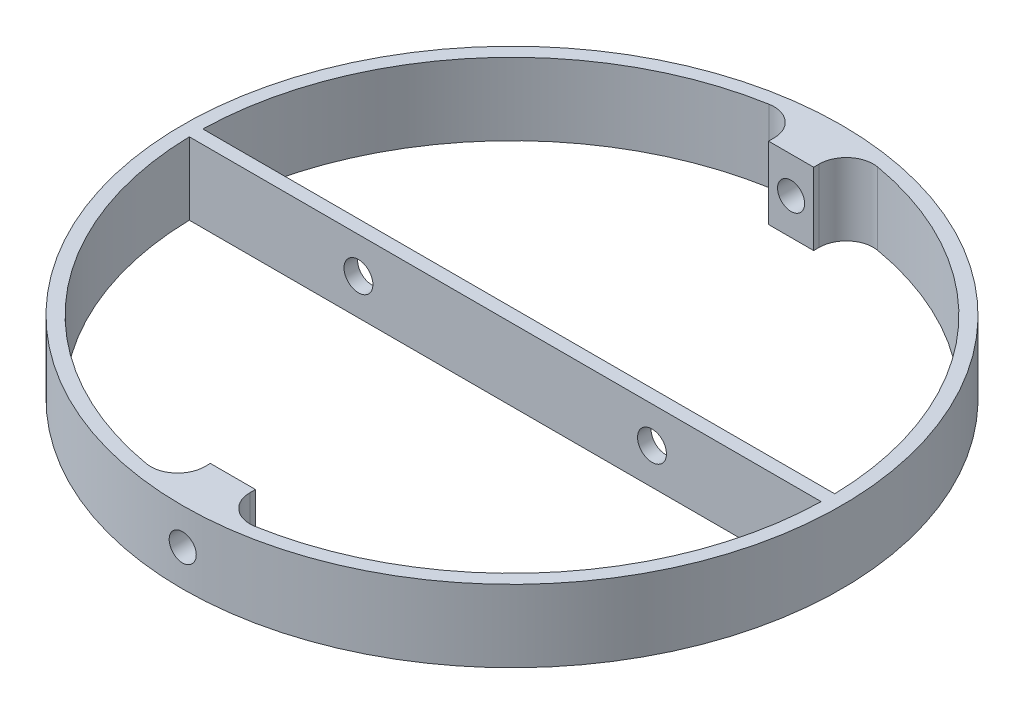
from build123d import *

# Parameters (mm, degrees)
ESQUISSE1_R             = 36.5
ESQUISSE1_R_2           = 35
BOSS_EXTRU_1_DEPTH      = 4
ENL_V_MAT_EXTRU_1_REACH = 83.714
ESQUISSE3_R             = 1.5
ENL_V_MAT_EXTRU_2_REACH = 54.305
ESQUISSE2_R             = 1.6
CONG_1_R                = 3


with BuildPart() as part:
    # Esquisse1 → Boss.-Extru.1 (new, symmetric)
    # profile 1 of 7: a face of its own
    with BuildSketch(Plane(origin=(0, 0, 0), x_dir=(1, 0, 0), z_dir=(0, 1, 0))):
        with Locations(Location((0, 0, 0), (0, 0, 270))):
            Circle(ESQUISSE1_R)
        Circle(ESQUISSE1_R_2, mode=Mode.SUBTRACT)
    # profile 2 of 7: a face of its own
    with BuildSketch(Plane(origin=(0, 0, 0), x_dir=(1, 0, 0), z_dir=(0, 1, 0))):
        with BuildLine():
            Line((34.991963363, 0.75), (0, 0.75))
            Line((0, 0.75), (0, -0.75))
            Line((0, -0.75), (34.991963363, -0.75))
            ThreePointArc((34.991963363, -0.75), (34.997990783, -0.375021529), (35, 0))
            ThreePointArc((35, 0), (34.997990783, 0.375021529), (34.991963363, 0.75))
        make_face()
    # profile 3 of 7: a face of its own
    with BuildSketch(Plane(origin=(0, 0, 0), x_dir=(1, 0, 0), z_dir=(0, 1, 0))):
        with BuildLine():
            Line((0, 0.75), (-34.991963363, 0.75))
            ThreePointArc((-34.991963363, 0.75), (-35, 0), (-34.991963363, -0.75))
            Line((-34.991963363, -0.75), (0, -0.75))
            Line((0, -0.75), (0, 0.75))
        make_face()
    # profile 4 of 7: a face of its own
    with BuildSketch(Plane(origin=(0, 0, 0), x_dir=(1, 0, 0), z_dir=(0, 1, 0))):
        with BuildLine():
            Line((0, 0.75), (-34.991963363, 0.75))
            ThreePointArc((-34.991963363, 0.75), (-35, 0), (-34.991963363, -0.75))
            Line((-34.991963363, -0.75), (0, -0.75))
            Line((0, -0.75), (0, 0.75))
        make_face()
    # profile 5 of 7: a face of its own
    with BuildSketch(Plane(origin=(0, 0, 0), x_dir=(1, 0, 0), z_dir=(0, 1, 0))):
        with BuildLine():
            Line((34.991963363, 0.75), (0, 0.75))
            Line((0, 0.75), (0, -0.75))
            Line((0, -0.75), (34.991963363, -0.75))
            ThreePointArc((34.991963363, -0.75), (34.997990783, -0.375021529), (35, 0))
            ThreePointArc((35, 0), (34.997990783, 0.375021529), (34.991963363, 0.75))
        make_face()
    # profile 6 of 7: a face of its own
    with BuildSketch(Plane(origin=(0, 0, 0), x_dir=(1, 0, 0), z_dir=(0, 1, 0))):
        with BuildLine():
            Line((-2.5, -30.910600109), (-2.5, -34.910600109))
            ThreePointArc((-2.5, -34.910600109), (0, -35), (2.5, -34.910600109))
            Line((2.5, -34.910600109), (2.5, -30.910600109))
            Line((2.5, -30.910600109), (-2.5, -30.910600109))
        make_face()
    # profile 7 of 7: a face of its own
    with BuildSketch(Plane(origin=(0, 0, 0), x_dir=(1, 0, 0), z_dir=(0, 1, 0))):
        with BuildLine():
            ThreePointArc((2.5, 34.910600109), (0, 35), (-2.5, 34.910600109))
            Line((-2.5, 34.910600109), (-2.5, 30.910600109))
            Line((-2.5, 30.910600109), (2.5, 30.910600109))
            Line((2.5, 30.910600109), (2.5, 34.910600109))
        make_face()
    extrude(amount=BOSS_EXTRU_1_DEPTH, both=True)

    # Esquisse3 → Enlèv. mat.-Extru.1 (cut, up to next)
    with BuildSketch(Plane.XY.offset(36.5), mode=Mode.PRIVATE) as enl_v_mat_extru_1_sk1:
        Circle(ESQUISSE3_R)
    enl_v_mat_extru_1_tool1 = extrude(enl_v_mat_extru_1_sk1.sketch, amount=-ENL_V_MAT_EXTRU_1_REACH, mode=Mode.PRIVATE) & part.part
    enl_v_mat_extru_1 = enl_v_mat_extru_1_tool1.solids().sort_by_distance((0, 0, 36.5))[0]
    add(enl_v_mat_extru_1, mode=Mode.SUBTRACT)

    # Symétrie1: Enlèv. mat.-Extru.1 across plane
    add(enl_v_mat_extru_1.mirror(Plane.XY), mode=Mode.SUBTRACT)

    # Esquisse2 → Enlèv. mat.-Extru.2 (cut, up to next)
    with BuildSketch(Plane.XY.offset(0.75), mode=Mode.PRIVATE) as enl_v_mat_extru_2_sk1:
        with Locations((-16.256, 0)):
            Circle(ESQUISSE2_R)
    enl_v_mat_extru_2_tool1 = extrude(enl_v_mat_extru_2_sk1.sketch, amount=-ENL_V_MAT_EXTRU_2_REACH, mode=Mode.PRIVATE) & part.part
    # Esquisse2 → Enlèv. mat.-Extru.2 (cut, up to next)
    with BuildSketch(Plane.XY.offset(0.75), mode=Mode.PRIVATE) as enl_v_mat_extru_2_sk2:
        with Locations((16.256, 0)):
            Circle(ESQUISSE2_R)
    enl_v_mat_extru_2_tool2 = extrude(enl_v_mat_extru_2_sk2.sketch, amount=-ENL_V_MAT_EXTRU_2_REACH, mode=Mode.PRIVATE) & part.part
    add(enl_v_mat_extru_2_tool1.solids().sort_by_distance((-16.256, 0, 0.75))[0], mode=Mode.SUBTRACT)
    add(enl_v_mat_extru_2_tool2.solids().sort_by_distance((16.256, 0, 0.75))[0], mode=Mode.SUBTRACT)

    # Congé1
    cong_1_edges = [part.edges().sort_by_distance(p)[0] for p in [
        (2.5, 0, -34.910600109),
        (-2.5, 0, -34.910600109),
        (-2.5, 0, 34.910600109),
        (2.5, 0, 34.910600109),
    ]]
    fillet(cong_1_edges, radius=CONG_1_R)


solid = part.part
